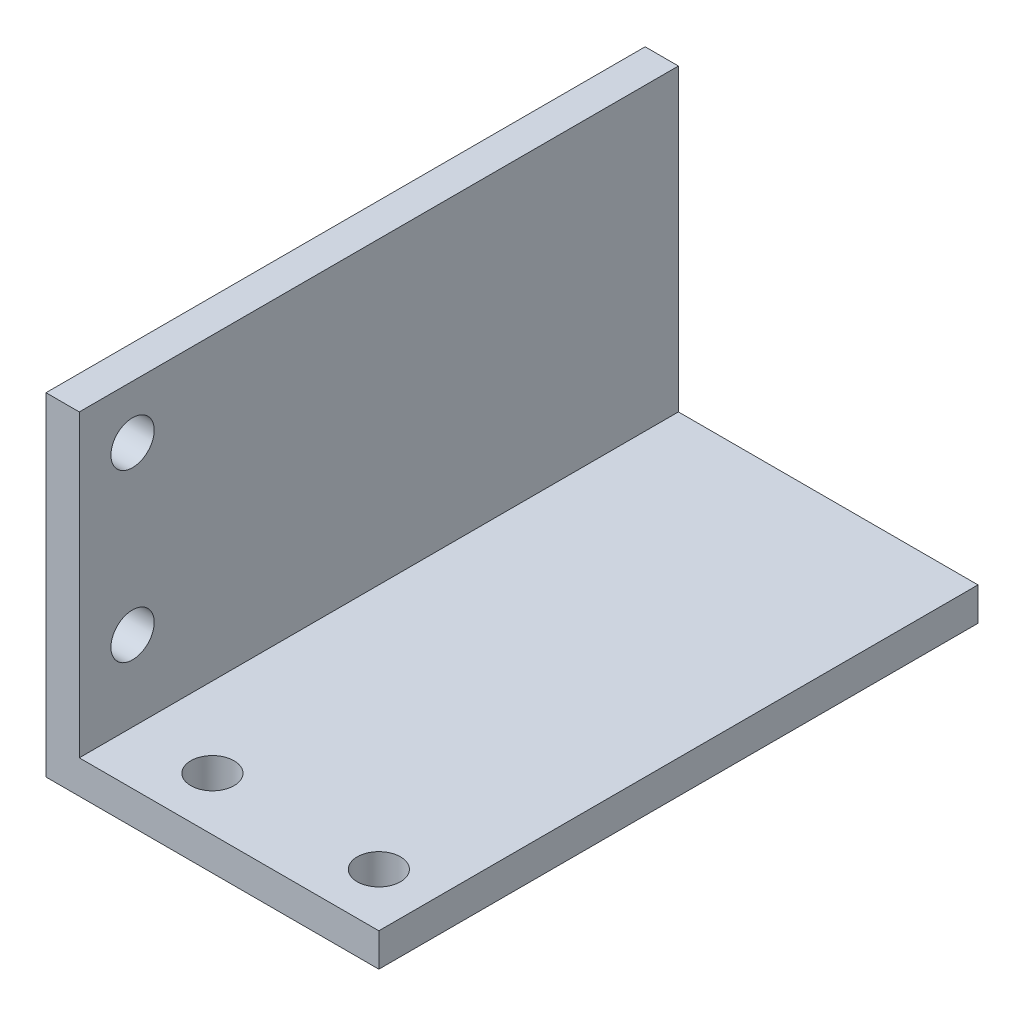
from build123d import *

# Parameters (mm, degrees)
ESTRUSIONE_ESTRUSIONE1_DEPTH = 90
FORO_6_5_6_5_1_D             = 6.5
FORO_6_5_6_5_2_D             = 6.5
FORO_6_5_6_5_2_DEPTH         = 5
FORO_6_5_6_5_2_TIP           = 1.952797012


with BuildPart() as part:
    # Schizzo1 → Estrusione-Estrusione1 (new body)
    with BuildSketch(Plane.XY):
        Polygon((0, 0), (0, 50), (5, 50), (5, 5), (50, 5), (50, 0), align=None)
    extrude(amount=ESTRUSIONE_ESTRUSIONE1_DEPTH)

    # Foro Ø6.5 (6.5)-1 (through all)
    with Locations(Plane(origin=(0, 0, 0), x_dir=(-1, 0, 0), z_dir=(0, -1, 0))):
        with Locations((-17, -82), (-42, -82)):
            Hole(FORO_6_5_6_5_1_D / 2)

    # Foro Ø6.5 (6.5)-2
    with Locations(Plane.ZY):
        with Locations((82, 42), (82, 17)):
            Hole(FORO_6_5_6_5_2_D / 2, depth=FORO_6_5_6_5_2_DEPTH)
            with Locations((0, 0, -(FORO_6_5_6_5_2_DEPTH + FORO_6_5_6_5_2_TIP / 2))):  # 118° drill point
                Cone(0, FORO_6_5_6_5_2_D / 2, FORO_6_5_6_5_2_TIP, mode=Mode.SUBTRACT)


solid = part.part
